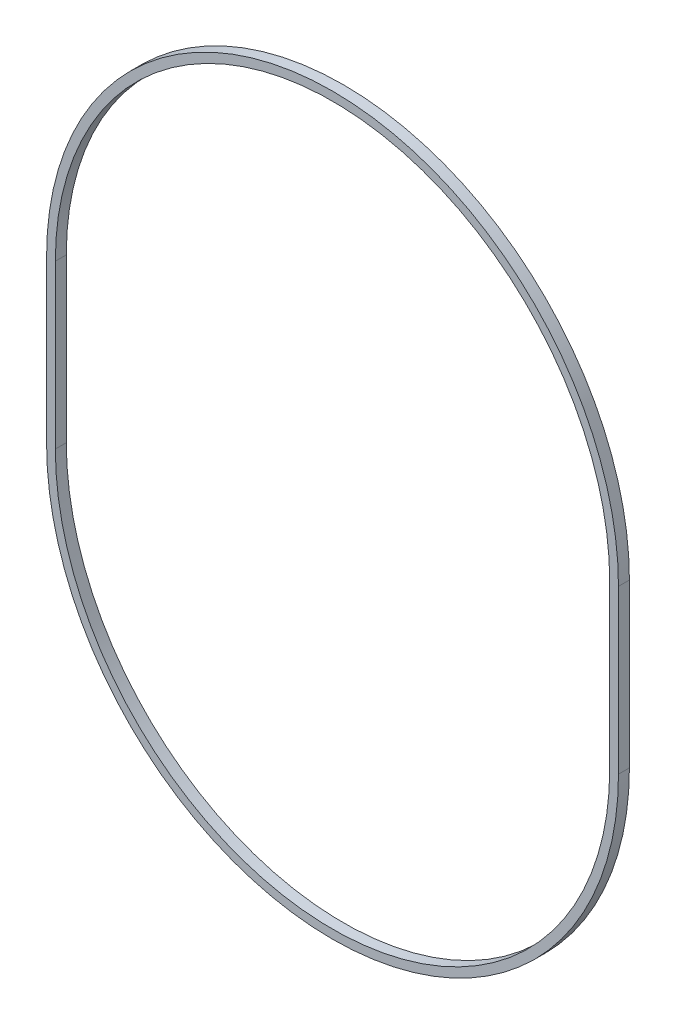
from build123d import *

# Parameters (mm, degrees)
BOSS_EXTRUDE1_DEPTH = 1.875


with BuildPart() as part:
    # Sketch1 → Boss-Extrude1 (new, symmetric)
    with BuildSketch(Plane.XY):
        with BuildLine():
            Line((-98, 27.875), (-98, -27.875))
            ThreePointArc((-98, -27.875), (0, -125.875), (98, -27.875))
            Line((98, -27.875), (98, 27.875))
            ThreePointArc((98, 27.875), (0, 125.875), (-98, 27.875))
        make_face()
        with BuildLine():
            ThreePointArc((-95, -27.875), (0, -122.875), (95, -27.875))
            Line((95, -27.875), (95, 27.875))
            ThreePointArc((95, 27.875), (0, 122.875), (-95, 27.875))
            Line((-95, 27.875), (-95, -27.875))
        make_face(mode=Mode.SUBTRACT)
    extrude(amount=BOSS_EXTRUDE1_DEPTH, both=True)


solid = part.part
